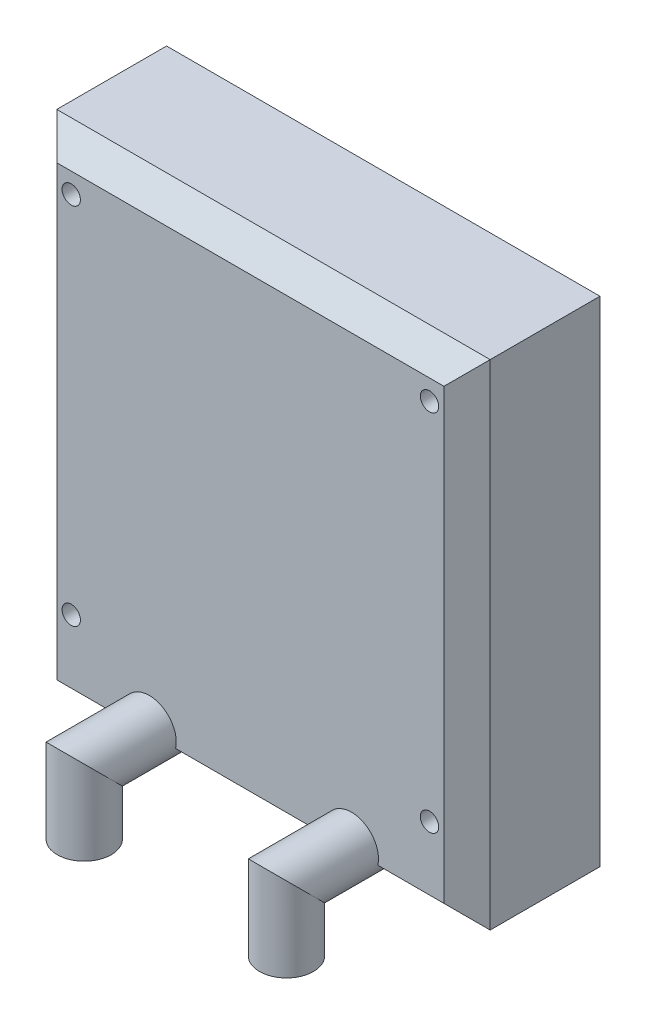
from build123d import *

# Parameters (mm, degrees)
SKETCH1_W           = 150
SKETCH1_H           = 171
BOSS_EXTRUDE1_DEPTH = 54
SKETCH2_R           = 3.175
CUT_EXTRUDE1_DEPTH  = 5.08
CHAMFER1_SIZE       = 8
SKETCH5_R           = 9.35


with BuildPart() as part:
    # Sketch1 → Boss-Extrude1 (new body)
    with BuildSketch(Plane.XY):
        Rectangle(SKETCH1_W, SKETCH1_H)
    extrude(amount=BOSS_EXTRUDE1_DEPTH)

    # Sketch2 → Cut-Extrude1 (cut)
    with BuildSketch(Plane.XY.offset(54)):
        with Locations((-62, 70.5)):
            Circle(SKETCH2_R)
        with Locations((62, 70.5)):
            Circle(SKETCH2_R)
        with Locations((62, -55.5)):
            Circle(SKETCH2_R)
        with Locations((-62, -55.5)):
            Circle(SKETCH2_R)
    cut_extrude1 = extrude(amount=-CUT_EXTRUDE1_DEPTH, mode=Mode.SUBTRACT)

    # Mirror1: Cut-Extrude1 across plane
    add(cut_extrude1.mirror(Plane.XY.offset(27)), mode=Mode.SUBTRACT)

    # Chamfer1
    chamfer1_edges = [part.edges().sort_by_distance(p)[0] for p in [
        (75, 0, 54),
        (0, -85.5, 54),
        (-75, 0, 54),
        (0, -85.5, 0),
        (75, 0, 0),
        (0, 85.5, 0),
        (-75, 0, 0),
        (0, 85.5, 54),
    ]]
    chamfer(chamfer1_edges, length=CHAMFER1_SIZE)

    # Sweep1: sweep along a path in Sketch6
    with BuildLine(Plane.ZY.offset(35)) as sweep1_path:
        Line((76.5, -98), (76.5, -75.5))
        Line((76.5, -75.5), (54, -75.5))
        Line((54, -75.5), (44, -75.5))
    # Sketch5 → Sweep1 (sweep)
    with BuildSketch(Plane.XY.offset(54)):
        with Locations((-35, -75.5)):
            Circle(SKETCH5_R)
    sweep1 = sweep(path=sweep1_path.line, transition=Transition.RIGHT)

    # Mirror2: Sweep1 across plane
    add(sweep1.mirror(Plane.ZY))


solid = part.part
